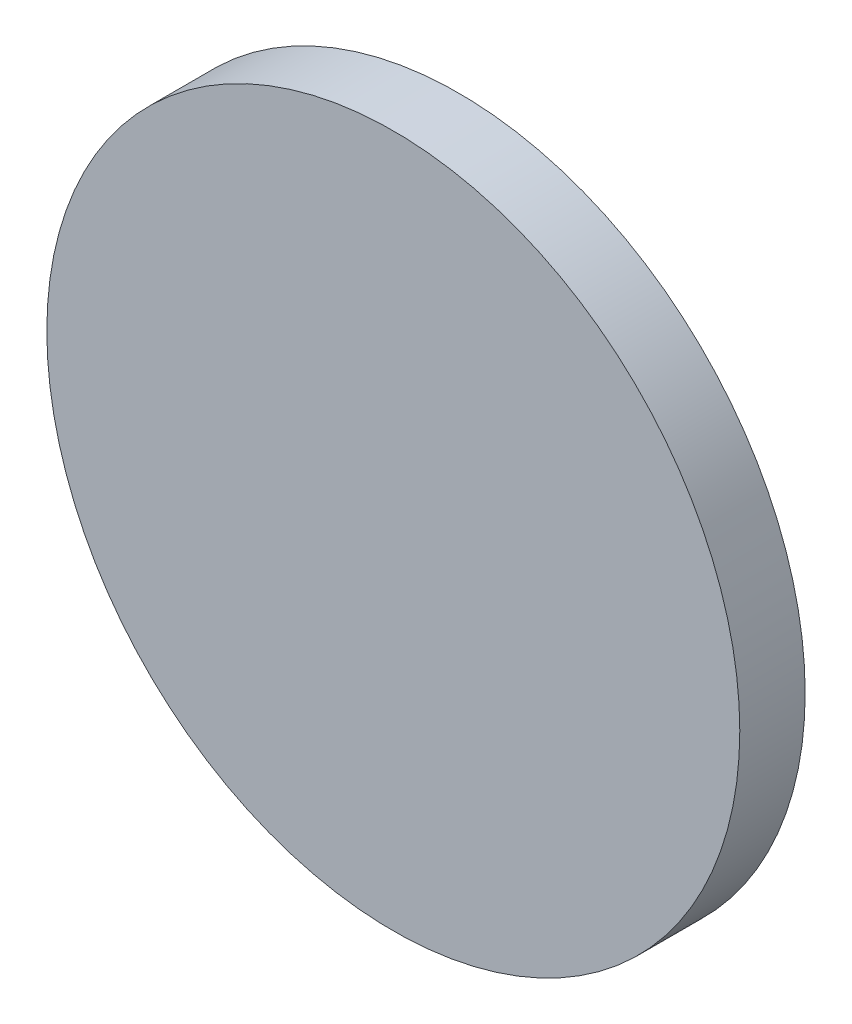
from build123d import *

# Parameters (mm, degrees)
SKETCH1_R           = 53
BOSS_EXTRUDE1_DEPTH = 10


with BuildPart() as part:
    # Sketch1 → Boss-Extrude1 (new body)
    with BuildSketch(Plane.XY):
        Circle(SKETCH1_R)
    extrude(amount=BOSS_EXTRUDE1_DEPTH)


solid = part.part
